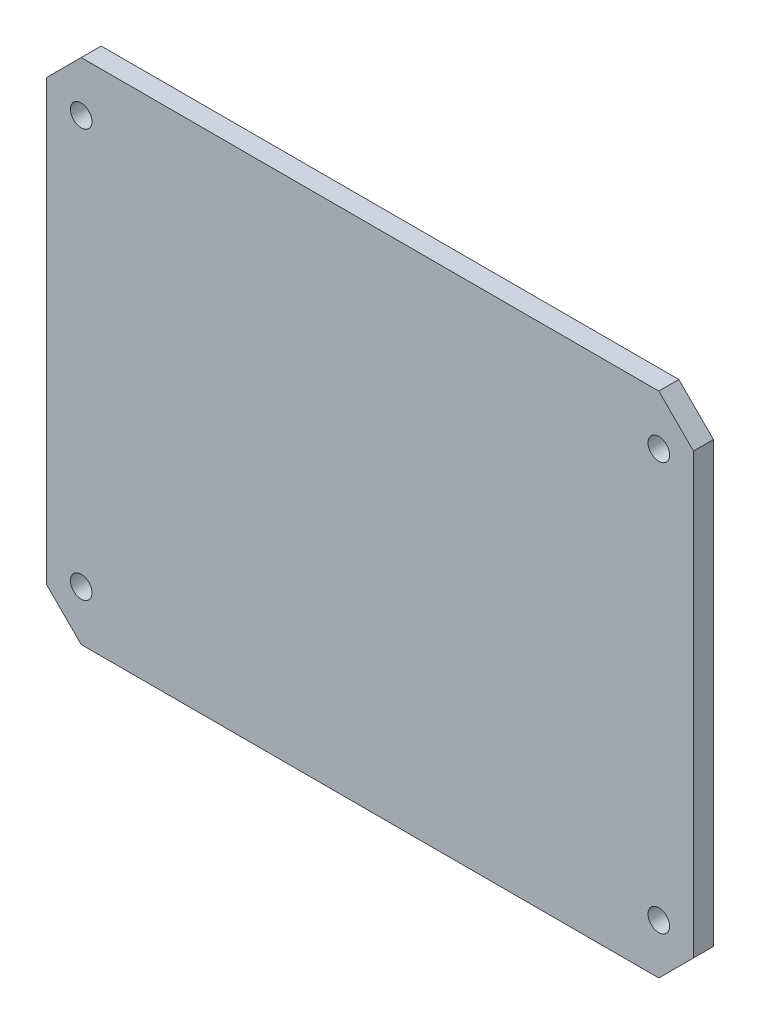
from build123d import *

# Parameters (mm, degrees)
F_84_X_66_COVER_FOUR_D2_8_HOLES_PROFILE_R = 1.4
F_84_X_66_COVER_FOUR_D2_8_HOLES_DEPTH     = 2.6


with BuildPart() as part:
    # 84 x 66 cover - four D2.8 holes profile → 84 x 66 cover - four D2.8 holes (new body)
    with BuildSketch(Plane.XY):
        Polygon((-37.5, -33), (37.5, -33), (42, -28.5), (42, 28.5), (37.5, 33), (-37.5, 33), (-42, 28.5), (-42, -28.5), align=None)
        with Locations((-37.5, -26.5)):
            Circle(F_84_X_66_COVER_FOUR_D2_8_HOLES_PROFILE_R, mode=Mode.SUBTRACT)
        with Locations((37.5, -26.5)):
            Circle(F_84_X_66_COVER_FOUR_D2_8_HOLES_PROFILE_R, mode=Mode.SUBTRACT)
        with Locations((-37.5, 26.5)):
            Circle(F_84_X_66_COVER_FOUR_D2_8_HOLES_PROFILE_R, mode=Mode.SUBTRACT)
        with Locations((37.5, 26.5)):
            Circle(F_84_X_66_COVER_FOUR_D2_8_HOLES_PROFILE_R, mode=Mode.SUBTRACT)
    extrude(amount=F_84_X_66_COVER_FOUR_D2_8_HOLES_DEPTH)


solid = part.part
